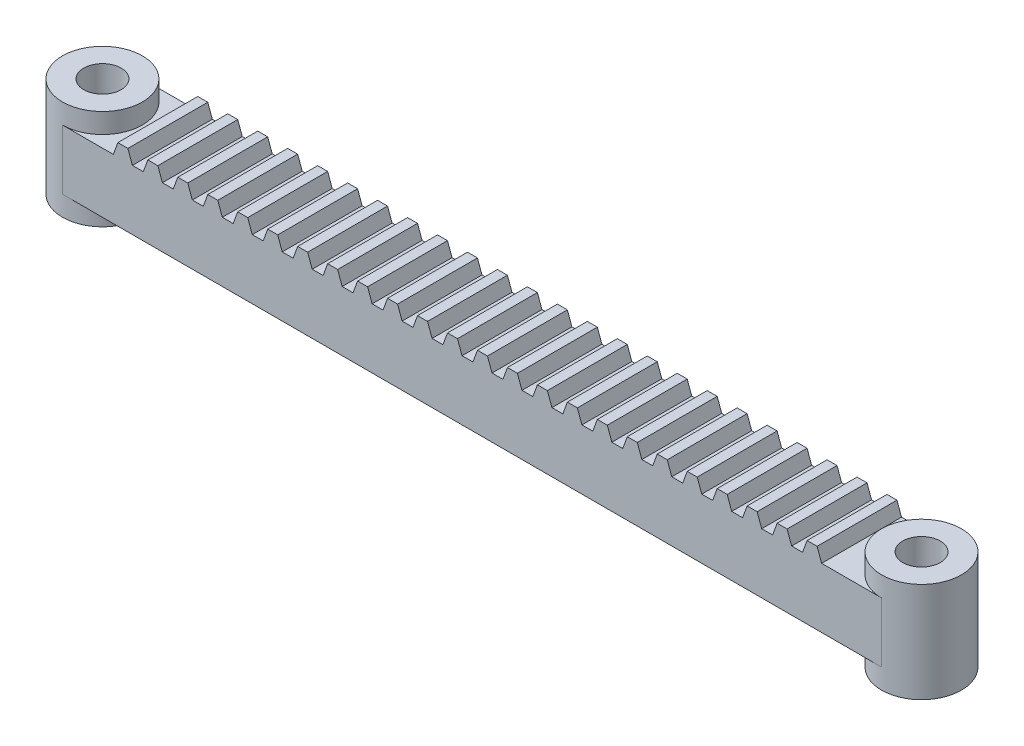
from build123d import *

# Parameters (mm, degrees)
BOSS_EXTRUDE1_DEPTH = 6
SKETCH2_3_R         = 8
SKETCH2_3_R_2       = 3.75
BOSS_EXTRUDE2_DEPTH = 10
BOSS_EXTRUDE3_DEPTH = 8
LPATTERN1_COUNT     = 24
LPATTERN1_PITCH     = 6


with BuildPart() as part:
    # Sketch2 → Boss-Extrude1 (new, symmetric)
    with BuildSketch(Plane(origin=(0, 0, 0), x_dir=(1, 0, 0), z_dir=(0, 1, 0))):
        with BuildLine():
            Line((82, 8), (-82, 8))
            ThreePointArc((-82, 8), (-76.343145751, 5.656854249), (-74, 0))
            ThreePointArc((-74, 0), (-76.343145751, -5.656854249), (-82, -8))
            Line((-82, -8), (82, -8))
            ThreePointArc((82, -8), (74, 0), (82, 8))
        make_face()
    extrude(amount=BOSS_EXTRUDE1_DEPTH, both=True)

    # Sketch2<3> → Boss-Extrude2 (add, symmetric)
    # profile 1 of 2: a face of its own
    with BuildSketch(Plane(origin=(0, 0, 0), x_dir=(1, 0, 0), z_dir=(0, 1, 0))):
        with Locations((-82, 0)):
            Circle(SKETCH2_3_R)
        with Locations((-82, 0)):
            Circle(SKETCH2_3_R_2, mode=Mode.SUBTRACT)
    # profile 2 of 2: a face of its own
    with BuildSketch(Plane(origin=(0, 0, 0), x_dir=(1, 0, 0), z_dir=(0, 1, 0))):
        with Locations((82, 0)):
            Circle(SKETCH2_3_R)
        with Locations((82, 0)):
            Circle(SKETCH2_3_R_2, mode=Mode.SUBTRACT)
    extrude(amount=BOSS_EXTRUDE2_DEPTH, both=True)

    # Sketch3 → Boss-Extrude3 (add, symmetric)
    with BuildSketch(Plane.XY):
        Polygon((70, 6), (69.090074414, 8.5), (67.090074414, 8.5), (66.180148829, 6), align=None)
    boss_extrude3 = extrude(amount=BOSS_EXTRUDE3_DEPTH, both=True)

    # LPattern1: Boss-Extrude3 ×24
    with Locations(*[(-i * LPATTERN1_PITCH, 0, 0) for i in range(1, LPATTERN1_COUNT)]):
        add(boss_extrude3)


solid = part.part
